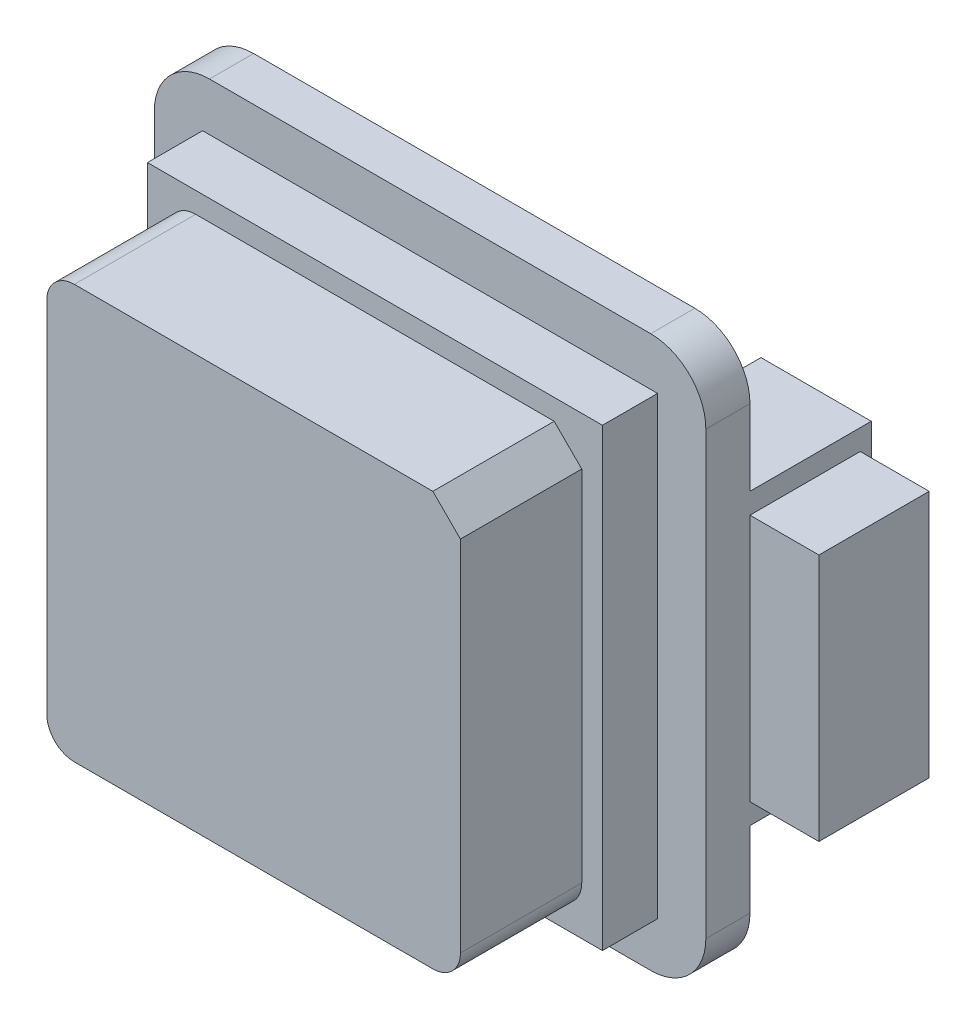
from build123d import *

# Parameters (mm, degrees)
BOSS_EXTRUDE1_DEPTH = 1.6
SKETCH2_W           = 16.5
SKETCH2_H           = 16.5
BOSS_EXTRUDE2_DEPTH = 2
BOSS_EXTRUDE3_DEPTH = 4.4
SKETCH5_W           = 4
SKETCH5_H           = 10.5
BOSS_EXTRUDE4_DEPTH = 4.4
SKETCH6_W           = 9
SKETCH6_H           = 4
BOSS_EXTRUDE5_DEPTH = 2.5


with BuildPart() as part:
    # Sketch1 → Boss-Extrude1 (new body)
    with BuildSketch(Plane(origin=(0, 0, 0), x_dir=(0, 1, 0), z_dir=(0, 0, 1))):
        with BuildLine():
            Line((-8, 10), (8, 10))
            ThreePointArc((8, 10), (9.414213562, 9.414213562), (10, 8))
            Line((10, 8), (10, -8))
            ThreePointArc((10, -8), (9.414213562, -9.414213562), (8, -10))
            Line((8, -10), (-8, -10))
            ThreePointArc((-8, -10), (-9.414213562, -9.414213562), (-10, -8))
            Line((-10, -8), (-10, 8))
            ThreePointArc((-10, 8), (-9.414213562, 9.414213562), (-8, 10))
        make_face()
    extrude(amount=BOSS_EXTRUDE1_DEPTH)

    # Sketch2 → Boss-Extrude2 (add)
    with BuildSketch(Plane.XY.offset(1.6)):
        Rectangle(SKETCH2_W, SKETCH2_H)
    extrude(amount=BOSS_EXTRUDE2_DEPTH)

    # Sketch3 → Boss-Extrude3 (add)
    with BuildSketch(Plane.XY.offset(3.6)):
        with BuildLine():
            Line((6.5, 7.5), (7.5, 6.5))
            Line((7.5, 6.5), (7.5, -6.5))
            ThreePointArc((7.5, -6.5), (7.207106781, -7.207106781), (6.5, -7.5))
            Line((6.5, -7.5), (-6.5, -7.5))
            ThreePointArc((-6.5, -7.5), (-7.207106781, -7.207106781), (-7.5, -6.5))
            Line((-7.5, -6.5), (-7.5, 6.5))
            ThreePointArc((-7.5, 6.5), (-7.207106781, 7.207106781), (-6.5, 7.5))
            Line((-6.5, 7.5), (6.5, 7.5))
        make_face()
    extrude(amount=BOSS_EXTRUDE3_DEPTH)

    # Sketch5 → Boss-Extrude4 (add)
    with BuildSketch(Plane(origin=(0, 0, 0), x_dir=(1, 0, 0), z_dir=(0, 0, -1))):
        with Locations((-8, 0)):
            Rectangle(SKETCH5_W, SKETCH5_H)
        with Locations((8, 0)):
            Rectangle(SKETCH5_W, SKETCH5_H)
    extrude(amount=BOSS_EXTRUDE4_DEPTH)

    # Sketch6 → Boss-Extrude5 (add)
    with BuildSketch(Plane(origin=(10, 0, 0), x_dir=(0, -1, 0), z_dir=(-1, 0, 0))):
        with Locations((0, -2)):
            Rectangle(SKETCH6_W, SKETCH6_H)
    extrude(amount=-BOSS_EXTRUDE5_DEPTH)


solid = part.part
